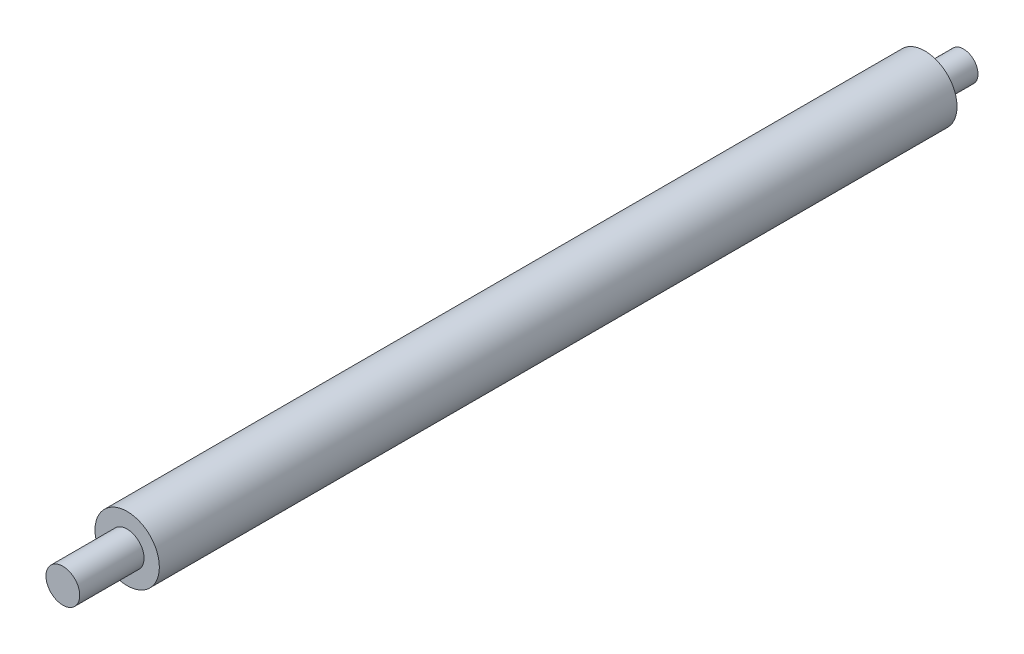
from build123d import *

# Parameters (mm, degrees)
SKETCH1_R           = 25
BOSS_EXTRUDE1_DEPTH = 700
CUT_EXTRUDE1_START  = -50
SKETCH2_R           = 25
SKETCH2_R_2         = 13.119240587
CUT_EXTRUDE1_DEPTH  = 50
SKETCH3_R           = 25
SKETCH3_R_2         = 11.320441419
CUT_EXTRUDE2_DEPTH  = 30


with BuildPart() as part:
    # Sketch1 → Boss-Extrude1 (new body)
    with BuildSketch(Plane.XY):
        Circle(SKETCH1_R)
    extrude(amount=BOSS_EXTRUDE1_DEPTH)

    # Sketch2 → Cut-Extrude1 (cut)
    with BuildSketch(Plane.XY.offset(700).offset(CUT_EXTRUDE1_START)):
        Circle(SKETCH2_R)
        Circle(SKETCH2_R_2, mode=Mode.SUBTRACT)
    extrude(amount=CUT_EXTRUDE1_DEPTH, mode=Mode.SUBTRACT)

    # Sketch3 → Cut-Extrude2 (cut)
    with BuildSketch(Plane(origin=(0, 0, 0), x_dir=(-1, 0, 0), z_dir=(0, 0, -1))):
        Circle(SKETCH3_R)
        Circle(SKETCH3_R_2, mode=Mode.SUBTRACT)
    extrude(amount=-CUT_EXTRUDE2_DEPTH, mode=Mode.SUBTRACT)


solid = part.part
